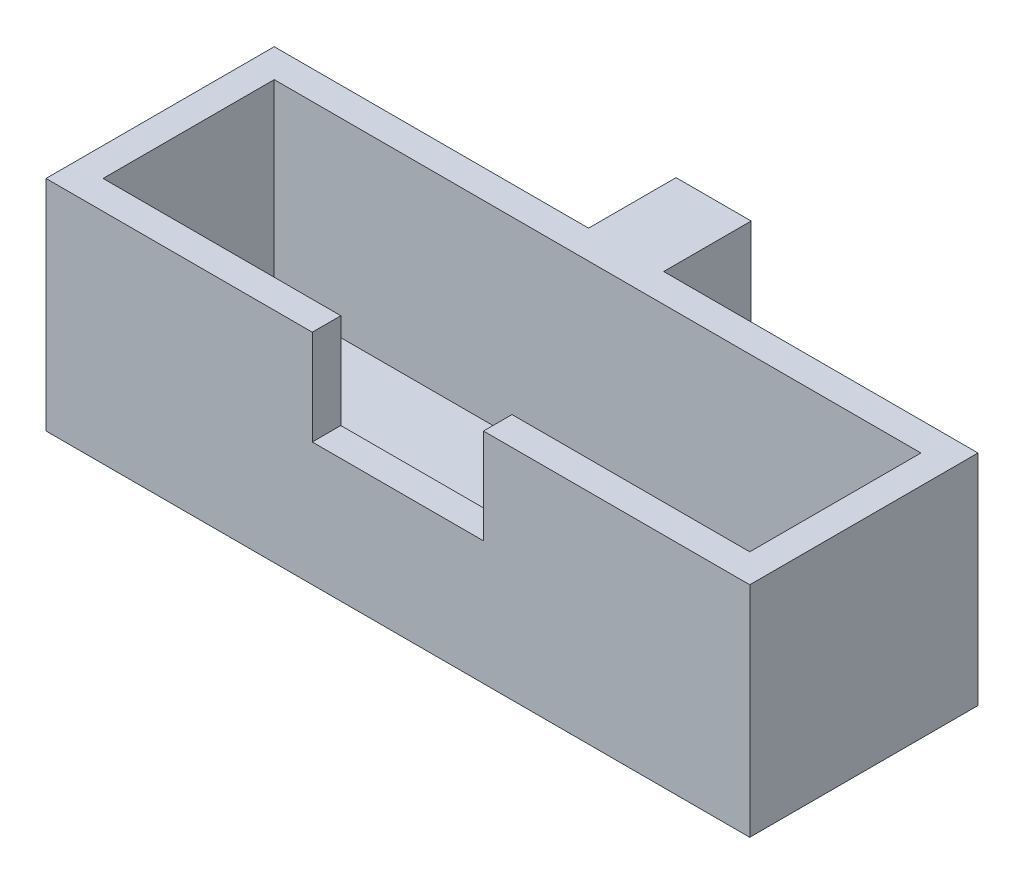
from build123d import *

# Parameters (mm, degrees)
SKETCH1_W           = 74
SKETCH1_H           = 24
SKETCH1_W_2         = 68
SKETCH1_H_2         = 18
BOSS_EXTRUDE1_DEPTH = 20
SKETCH1_3_W         = 74
SKETCH1_3_H         = 24
BOSS_EXTRUDE2_DEPTH = 3
CUT_EXTRUDE1_REACH  = 61.463
SKETCH4_W           = 18
SKETCH4_H           = 10
SKETCH5_W           = 7.9
SKETCH5_H           = 23
BOSS_EXTRUDE3_DEPTH = 9.2


with BuildPart() as part:
    # Sketch1 → Boss-Extrude1 (new body)
    with BuildSketch(Plane(origin=(0, 0, 0), x_dir=(1, 0, 0), z_dir=(0, 1, 0))):
        with Locations((14.912280702, -12.336842105)):
            Rectangle(SKETCH1_W, SKETCH1_H)
        with Locations((14.912280702, -12.336842105)):
            Rectangle(SKETCH1_W_2, SKETCH1_H_2, mode=Mode.SUBTRACT)
    extrude(amount=BOSS_EXTRUDE1_DEPTH)

    # Sketch1<3> → Boss-Extrude2 (add)
    with BuildSketch(Plane(origin=(0, 0, 0), x_dir=(1, 0, 0), z_dir=(0, 1, 0))):
        with Locations((14.912280702, -12.336842105)):
            Rectangle(SKETCH1_3_W, SKETCH1_3_H)
    extrude(amount=-BOSS_EXTRUDE2_DEPTH)

    # Sketch4 → Cut-Extrude1 (cut, up to next)
    with BuildSketch(Plane(origin=(0, 0, 21.336842105), x_dir=(-1, 0, 0), z_dir=(0, 0, -1)), mode=Mode.PRIVATE) as cut_extrude1_sk1:
        with Locations((-14.912280702, 15)):
            Rectangle(SKETCH4_W, SKETCH4_H)
    cut_extrude1_tool1 = extrude(cut_extrude1_sk1.sketch, amount=-CUT_EXTRUDE1_REACH, mode=Mode.PRIVATE) & part.part
    add(cut_extrude1_tool1.solids().sort_by_distance((14.912281, 15, 21.336842))[0], mode=Mode.SUBTRACT)

    # Sketch5 → Boss-Extrude3 (add)
    with BuildSketch(Plane(origin=(0, 0, 0.336842105), x_dir=(-1, 0, 0), z_dir=(0, 0, -1))):
        with Locations((-14.912280702, 8.5)):
            Rectangle(SKETCH5_W, SKETCH5_H)
    extrude(amount=BOSS_EXTRUDE3_DEPTH)


solid = part.part
